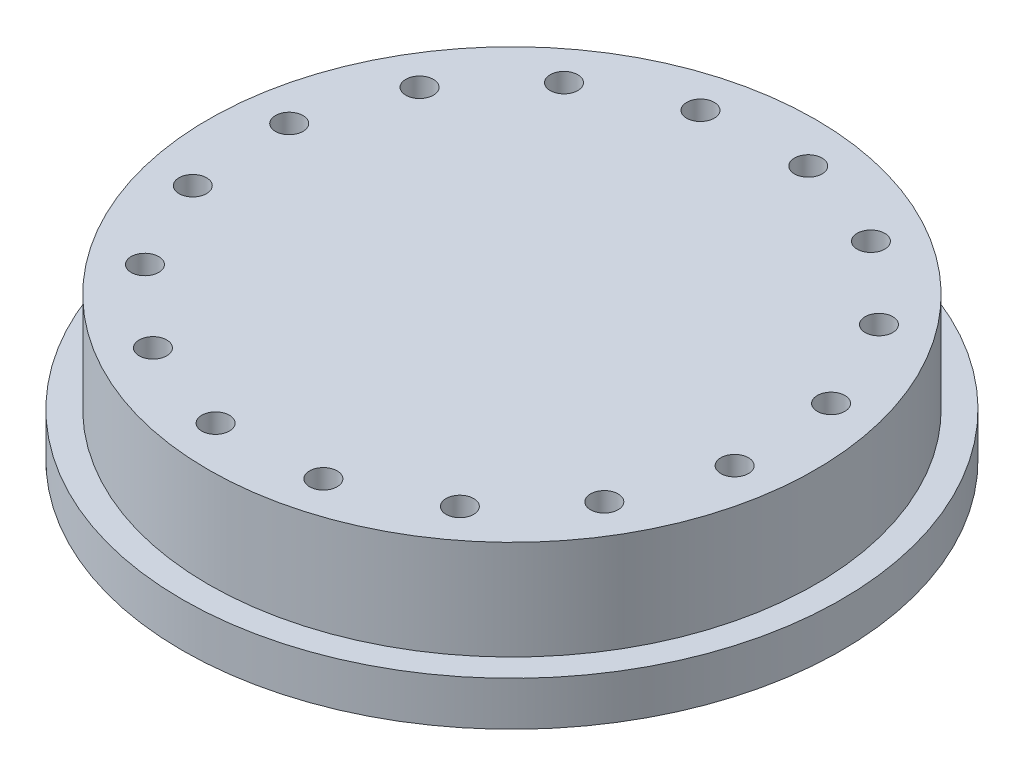
from build123d import *

# Parameters (mm, degrees)
SKETCH1_R               = 29.86111111
BOSS_EXTRUDE1_DEPTH     = 2
SKETCH2_R               = 27.5
BOSS_EXTRUDE2_DEPTH     = 9
CUT_EXTRUDE1_DEPTH      = 45.185652801
CUT_EXTRUDE1_DEPTH_BACK = 45.185652801
SKETCH3_R               = 1.25


with BuildPart() as part:
    # Sketch1 → Boss-Extrude1 (new, symmetric)
    with BuildSketch(Plane(origin=(0, 0, 0), x_dir=(1, 0, 0), z_dir=(0, 1, 0))):
        with Locations(Location((0, 0, 0), (0, 0, 270))):
            Circle(SKETCH1_R)
    extrude(amount=BOSS_EXTRUDE1_DEPTH, both=True)

    # Sketch2 → Boss-Extrude2 (add)
    with BuildSketch(Plane(origin=(0, 2, 0), x_dir=(1, 0, 0), z_dir=(0, 1, 0))):
        with Locations(Location((0, 0, 0), (0, 0, 270))):
            Circle(SKETCH2_R)
    extrude(amount=BOSS_EXTRUDE2_DEPTH)

    # Sketch3 → Cut-Extrude1 (cut, two sides: drawn at the far end of the back side and taken through both)
    with BuildSketch(Plane.XZ.offset(2).offset(-CUT_EXTRUDE1_DEPTH_BACK)):
        with Locations(Location((23.000954051, -5.917652637, 0), (0, 0, 270))):
            Circle(SKETCH3_R)
        with Locations(Location((23.514698299, 3.334885892, 0), (0, 0, 270))):
            Circle(SKETCH3_R)
        with Locations(Location((20.448542892, 12.079718275, 0), (0, 0, 270))):
            Circle(SKETCH3_R)
        with Locations(Location((14.269282196, 18.985523054, 0), (0, 0, 270))):
            Circle(SKETCH3_R)
        with Locations(Location((18.985523054, -14.269282196, 0), (0, 0, 270))):
            Circle(SKETCH3_R)
        with Locations(Location((5.917652637, 23.000954051, 0), (0, 0, 270))):
            Circle(SKETCH3_R)
        with Locations(Location((-3.334885892, 23.514698299, 0), (0, 0, 270))):
            Circle(SKETCH3_R)
        with Locations(Location((-12.079718275, 20.448542892, 0), (0, 0, 270))):
            Circle(SKETCH3_R)
        with Locations(Location((-18.985523054, 14.269282196, 0), (0, 0, 270))):
            Circle(SKETCH3_R)
        with Locations(Location((-23.000954051, 5.917652637, 0), (0, 0, 270))):
            Circle(SKETCH3_R)
        with Locations(Location((-23.514698299, -3.334885892, 0), (0, 0, 270))):
            Circle(SKETCH3_R)
        with Locations(Location((12.079718275, -20.448542892, 0), (0, 0, 270))):
            Circle(SKETCH3_R)
        with Locations(Location((3.334885892, -23.514698299, 0), (0, 0, 270))):
            Circle(SKETCH3_R)
        with Locations(Location((-5.917652637, -23.000954051, 0), (0, 0, 270))):
            Circle(SKETCH3_R)
        with Locations(Location((-14.269282196, -18.985523054, 0), (0, 0, 270))):
            Circle(SKETCH3_R)
        with Locations(Location((-20.448542892, -12.079718275, 0), (0, 0, 270))):
            Circle(SKETCH3_R)
    extrude(amount=CUT_EXTRUDE1_DEPTH + CUT_EXTRUDE1_DEPTH_BACK, mode=Mode.SUBTRACT)


solid = part.part
